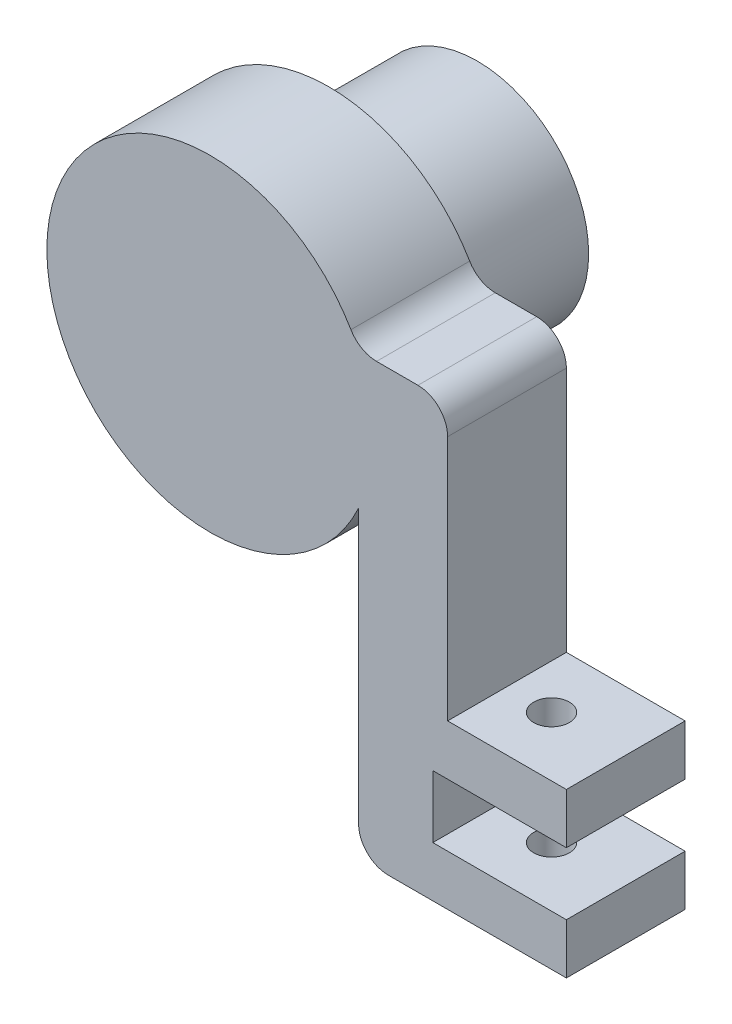
from build123d import *

# Parameters (mm, degrees)
BOSS_EXTRU_1_DEPTH      = 8
ENL_V_MAT_EXTRU_1_REACH = 45.749
ESQUISSE2_R             = 1
D_GAGEMENT_M21_D        = 2.4
D_GAGEMENT_M21_DEPTH    = 11
D_GAGEMENT_M21_TIP      = 0.721032743
CONG_1_R                = 2
ESQUISSE6_R             = 7.5
BOSS_EXTRU_3_DEPTH      = 10


with BuildPart() as part:
    # Esquisse1 → Boss.-Extru.1 (new body)
    with BuildSketch(Plane.XY):
        with BuildLine():
            Line((21, -6.417424305), (27, -6.417424305))
            Line((27, -6.417424305), (27, -25))
            Line((27, -25), (35, -25))
            Line((35, -25), (35, -28.4))
            Line((35, -28.4), (26, -28.4))
            Line((26, -28.4), (26, -32.6))
            Line((26, -32.6), (35, -32.6))
            Line((35, -32.6), (35, -36))
            Line((35, -36), (21, -36))
            Line((21, -36), (21, -15.582575695))
            ThreePointArc((21, -15.582575695), (0, -11), (21, -6.417424305))
        make_face()
    extrude(amount=BOSS_EXTRU_1_DEPTH)

    # Enlèv. mat.-Extru.1: up to this face of the body (flat: up to its plane)
    enl_v_mat_extru_1_end = Plane(part.part.faces().sort_by_distance((28, -36, 4))[0])
    # Esquisse2 → Enlèv. mat.-Extru.1 (cut, up to the picked face)
    with BuildSketch(Plane(origin=(0, -25, 0), x_dir=(1, 0, 0), z_dir=(0, 1, 0)), mode=Mode.PRIVATE) as enl_v_mat_extru_1_sk1:
        with Locations(Location((30, -4, 0), (0, 0, 270))):
            Circle(ESQUISSE2_R)
    enl_v_mat_extru_1_tool1 = split(extrude(enl_v_mat_extru_1_sk1.sketch, amount=-ENL_V_MAT_EXTRU_1_REACH, mode=Mode.PRIVATE), bisect_by=enl_v_mat_extru_1_end, keep=Keep.BOTH, mode=Mode.PRIVATE)
    add(enl_v_mat_extru_1_tool1.solids().sort_by(Axis((30, -25, 4), (0, -1, 0)))[0], mode=Mode.SUBTRACT)

    # Dégagement M21
    with Locations(Plane(origin=(0, -25, 0), x_dir=(1, 0, 0), z_dir=(0, 1, 0))):
        with Locations((30, -4)):
            Hole(D_GAGEMENT_M21_D / 2, depth=D_GAGEMENT_M21_DEPTH)
            with Locations((0, 0, -(D_GAGEMENT_M21_DEPTH + D_GAGEMENT_M21_TIP / 2))):  # 118° drill point
                Cone(0, D_GAGEMENT_M21_D / 2, D_GAGEMENT_M21_TIP, mode=Mode.SUBTRACT)

    # Congé1
    cong_1_edges = [part.edges().sort_by_distance(p)[0] for p in [
        (21, -36, 4),
        (21, -6.417424305, 4),
        (27, -6.417424305, 4),
    ]]
    fillet(cong_1_edges, radius=CONG_1_R)

    # Esquisse6 → Boss.-Extru.3 (add)
    with BuildSketch(Plane(origin=(0, 0, 0), x_dir=(-1, 0, 0), z_dir=(0, 0, -1))):
        with Locations(Location((-11, -11, 0), (0, 0, 180))):
            Circle(ESQUISSE6_R)
    extrude(amount=BOSS_EXTRU_3_DEPTH)


solid = part.part
